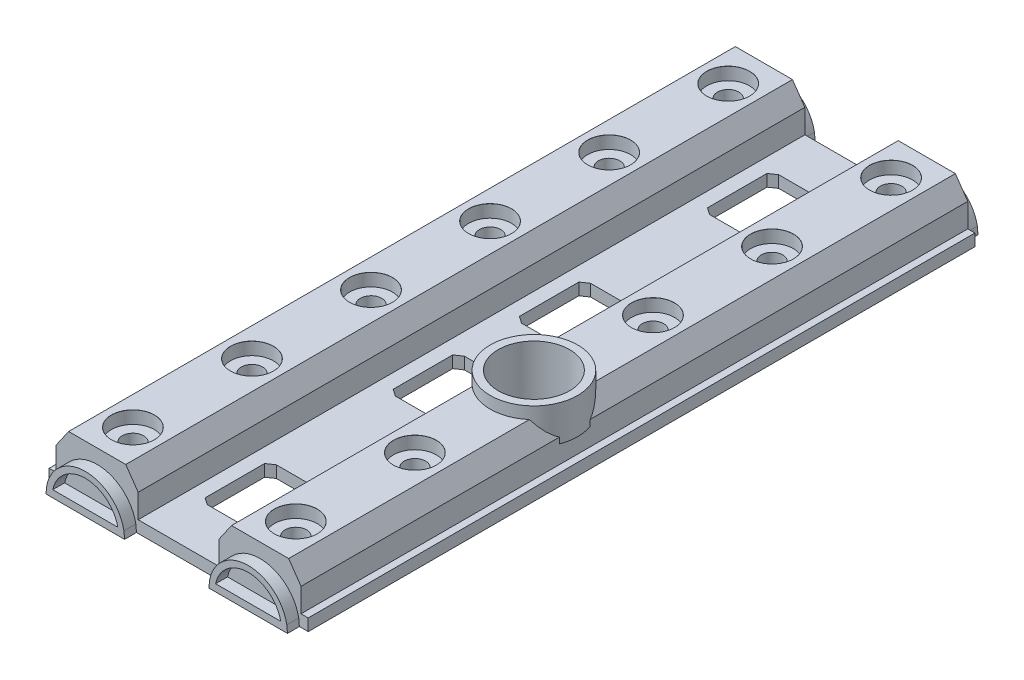
from build123d import *

# Parameters (mm, degrees)
BOSS_EXTRUDE1_DEPTH                         = 280
BOSS_EXTRUDE3_DEPTH                         = 5
MIRROR2_COPY_1_DEPTH                        = 5
CBORE_SLOT_FOR_M8_HEX_HEAD_BOLT1_AT_2_COUNT = 2
CBORE_SLOT_FOR_M8_HEX_HEAD_BOLT1_AT_2_PITCH = 50
CBORE_SLOT_FOR_M8_HEX_HEAD_BOLT1_AT_3_COUNT = 2
CBORE_SLOT_FOR_M8_HEX_HEAD_BOLT1_AT_3_PITCH = 100
CBORE_SLOT_FOR_M8_HEX_HEAD_BOLT1_AT_4_COUNT = 2
CBORE_SLOT_FOR_M8_HEX_HEAD_BOLT1_AT_4_PITCH = 150
CBORE_SLOT_FOR_M8_HEX_HEAD_BOLT1_AT_5_COUNT = 2
CBORE_SLOT_FOR_M8_HEX_HEAD_BOLT1_AT_5_PITCH = 200
CBORE_SLOT_FOR_M8_HEX_HEAD_BOLT1_AT_6_COUNT = 2
CBORE_SLOT_FOR_M8_HEX_HEAD_BOLT1_AT_6_PITCH = 250
BOSS_EXTRUDE4_DEPTH                         = 5
BOSS_EXTRUDE4_DEPTH_BACK                    = 10
SKETCH12_R                                  = 18.373536693
SKETCH14_R                                  = 15
CUT_EXTRUDE1_DEPTH                          = 28
CUT_EXTRUDE2_DEPTH                          = 294.662080045


with BuildPart() as part:
    # Sketch4 → Boss-Extrude1 (new body)
    with BuildSketch(Plane.XY):
        Polygon((-41.702855028, 2.5), (-38.702855028, 2.5), (-38.702855028, 12.5), (-33.495143371, 20), (-9.495143371, 20), (-4.287431713, 12.5), (-4.287431713, 2.5), (-1.287431713, 2.5), (26.712568287, 2.5), (29.712568287, 2.5), (29.712568287, 12.5), (34.920279944, 20), (58.920279944, 20), (64.127991602, 12.5), (64.127991602, 2.5), (67.127991602, 2.5), (67.127991602, -2.5), (26.712568287, -2.5), (-1.287431713, -2.5), (-41.702855028, -2.5), align=None)
    extrude(amount=-BOSS_EXTRUDE1_DEPTH)

    # Sketch5 → Boss-Extrude3 (add)
    with BuildSketch(Plane.XY):
        with BuildLine():
            ThreePointArc((-5.267870643, 0.487577586), (-21.495143371, 14), (-37.722416098, 0.487577586))
            Line((-37.722416098, 0.487577586), (-35.17265704, 0.487577586))
            ThreePointArc((-35.17265704, 0.487577586), (-21.495143371, 11.5), (-7.817629702, 0.487577586))
            Line((-7.817629702, 0.487577586), (-5.267870643, 0.487577586))
        make_face()
        Polygon((-37.722416098, 0.487577586), (-37.995143371, -2.5), (-4.995143371, -2.5), (-5.267870643, 0.487577586), (-7.817629702, 0.487577586), (-35.17265704, 0.487577586), align=None)
    boss_extrude3 = extrude(amount=BOSS_EXTRUDE3_DEPTH)

    # Mirror1: Boss-Extrude3 across plane
    add(boss_extrude3.mirror(Plane.ZY.offset(-12.712568287)))

    # Mirror2: Boss-Extrude3 across plane
    add(boss_extrude3.mirror(Plane.XY.offset(-140)))

    # Mirror2 copy 1 sketch → Mirror2 copy 1 (add)
    with BuildSketch(Plane(origin=(25.425136574, 0, -280), x_dir=(-1, 0, 0), z_dir=(0, 0, -1))):
        with BuildLine():
            ThreePointArc((-5.267870643, 0.487577586), (-21.495143371, 14), (-37.722416098, 0.487577586))
            Line((-37.722416098, 0.487577586), (-35.17265704, 0.487577586))
            ThreePointArc((-35.17265704, 0.487577586), (-21.495143371, 11.5), (-7.817629702, 0.487577586))
            Line((-7.817629702, 0.487577586), (-5.267870643, 0.487577586))
        make_face()
        Polygon((-37.722416098, 0.487577586), (-37.995143371, -2.5), (-4.995143371, -2.5), (-5.267870643, 0.487577586), (-7.817629702, 0.487577586), (-35.17265704, 0.487577586), align=None)
    extrude(amount=MIRROR2_COPY_1_DEPTH)

    # Sketch10 → CBORE SLOT for M8 Hex Head Bolt1 (revolve, cut)
    with BuildSketch(Plane(origin=(46.920279944, 20, -265), x_dir=(0, 0, 1), z_dir=(1, 0, 0))):
        Polygon((0, 0), (0, 34.543872786), (4.5, 31.84), (4.5, 5.3), (9.0055, 5.3), (9.0055, 0.025), (9.0305, 0), align=None)
    cbore_slot_for_m8_hex_head_bolt1 = revolve(axis=Axis((46.920279944, 26.35, -265), (0, -1, 0)), mode=Mode.SUBTRACT)

    # CBORE SLOT for M8 Hex Head Bolt1 at 2: CBORE SLOT for M8 Hex Head Bolt1 ×2
    with Locations(*[(0, 0, i * CBORE_SLOT_FOR_M8_HEX_HEAD_BOLT1_AT_2_PITCH) for i in range(1, CBORE_SLOT_FOR_M8_HEX_HEAD_BOLT1_AT_2_COUNT)]):
        add(cbore_slot_for_m8_hex_head_bolt1, mode=Mode.SUBTRACT)

    # CBORE SLOT for M8 Hex Head Bolt1 at 3: CBORE SLOT for M8 Hex Head Bolt1 ×2
    with Locations(*[(0, 0, i * CBORE_SLOT_FOR_M8_HEX_HEAD_BOLT1_AT_3_PITCH) for i in range(1, CBORE_SLOT_FOR_M8_HEX_HEAD_BOLT1_AT_3_COUNT)]):
        add(cbore_slot_for_m8_hex_head_bolt1, mode=Mode.SUBTRACT)

    # CBORE SLOT for M8 Hex Head Bolt1 at 4: CBORE SLOT for M8 Hex Head Bolt1 ×2
    with Locations(*[(0, 0, i * CBORE_SLOT_FOR_M8_HEX_HEAD_BOLT1_AT_4_PITCH) for i in range(1, CBORE_SLOT_FOR_M8_HEX_HEAD_BOLT1_AT_4_COUNT)]):
        add(cbore_slot_for_m8_hex_head_bolt1, mode=Mode.SUBTRACT)

    # CBORE SLOT for M8 Hex Head Bolt1 at 5: CBORE SLOT for M8 Hex Head Bolt1 ×2
    with Locations(*[(0, 0, i * CBORE_SLOT_FOR_M8_HEX_HEAD_BOLT1_AT_5_PITCH) for i in range(1, CBORE_SLOT_FOR_M8_HEX_HEAD_BOLT1_AT_5_COUNT)]):
        add(cbore_slot_for_m8_hex_head_bolt1, mode=Mode.SUBTRACT)

    # CBORE SLOT for M8 Hex Head Bolt1 at 6: CBORE SLOT for M8 Hex Head Bolt1 ×2
    with Locations(*[(0, 0, i * CBORE_SLOT_FOR_M8_HEX_HEAD_BOLT1_AT_6_PITCH) for i in range(1, CBORE_SLOT_FOR_M8_HEX_HEAD_BOLT1_AT_6_COUNT)]):
        add(cbore_slot_for_m8_hex_head_bolt1, mode=Mode.SUBTRACT)

    # Mirror3: CBORE SLOT for M8 Hex Head Bolt1 across plane
    add(cbore_slot_for_m8_hex_head_bolt1.mirror(Plane.ZY.offset(-12.712568287)), mode=Mode.SUBTRACT)

    # Mirror3 copy 1 sketch → Mirror3 copy 1 (revolve, cut)
    with BuildSketch(Plane(origin=(-21.495143371, 20, -215), x_dir=(0, 0, 1), z_dir=(-1, 0, 0))):
        Polygon((0, 0), (0, -34.543872786), (4.5, -31.84), (4.5, -5.3), (9.0055, -5.3), (9.0055, -0.025), (9.0305, 0), align=None)
    revolve(axis=Axis((-21.495143371, 26.35, -215), (0, 1, 0)), mode=Mode.SUBTRACT)

    # Mirror3 copy 2 sketch → Mirror3 copy 2 (revolve, cut)
    with BuildSketch(Plane(origin=(-21.495143371, 20, -165), x_dir=(0, 0, 1), z_dir=(-1, 0, 0))):
        Polygon((0, 0), (0, -34.543872786), (4.5, -31.84), (4.5, -5.3), (9.0055, -5.3), (9.0055, -0.025), (9.0305, 0), align=None)
    revolve(axis=Axis((-21.495143371, 26.35, -165), (0, 1, 0)), mode=Mode.SUBTRACT)

    # Mirror3 copy 3 sketch → Mirror3 copy 3 (revolve, cut)
    with BuildSketch(Plane(origin=(-21.495143371, 20, -115), x_dir=(0, 0, 1), z_dir=(-1, 0, 0))):
        Polygon((0, 0), (0, -34.543872786), (4.5, -31.84), (4.5, -5.3), (9.0055, -5.3), (9.0055, -0.025), (9.0305, 0), align=None)
    revolve(axis=Axis((-21.495143371, 26.35, -115), (0, 1, 0)), mode=Mode.SUBTRACT)

    # Mirror3 copy 4 sketch → Mirror3 copy 4 (revolve, cut)
    with BuildSketch(Plane(origin=(-21.495143371, 20, -65), x_dir=(0, 0, 1), z_dir=(-1, 0, 0))):
        Polygon((0, 0), (0, -34.543872786), (4.5, -31.84), (4.5, -5.3), (9.0055, -5.3), (9.0055, -0.025), (9.0305, 0), align=None)
    revolve(axis=Axis((-21.495143371, 26.35, -65), (0, 1, 0)), mode=Mode.SUBTRACT)

    # Mirror3 copy 5 sketch → Mirror3 copy 5 (revolve, cut)
    with BuildSketch(Plane(origin=(-21.495143371, 20, -15), x_dir=(0, 0, 1), z_dir=(-1, 0, 0))):
        Polygon((0, 0), (0, -34.543872786), (4.5, -31.84), (4.5, -5.3), (9.0055, -5.3), (9.0055, -0.025), (9.0305, 0), align=None)
    revolve(axis=Axis((-21.495143371, 26.35, -15), (0, 1, 0)), mode=Mode.SUBTRACT)

    # Sketch12 → Boss-Extrude4 (add, two sides: drawn at the far end of the back side and taken through both)
    with BuildSketch(Plane(origin=(0, 20, 0), x_dir=(1, 0, 0), z_dir=(0, 1, 0)).offset(-BOSS_EXTRUDE4_DEPTH_BACK)):
        with Locations(Location((46.920279944, 115, 0), (0, 0, 270))):
            Circle(SKETCH12_R)
    extrude(amount=BOSS_EXTRUDE4_DEPTH + BOSS_EXTRUDE4_DEPTH_BACK)

    # Sketch14 → Cut-Extrude1 (cut)
    with BuildSketch(Plane(origin=(0, 25, 0), x_dir=(1, 0, 0), z_dir=(0, 1, 0))):
        with Locations(Location((46.920279944, 115, 0), (0, 0, 270))):
            Circle(SKETCH14_R)
    extrude(amount=-CUT_EXTRUDE1_DEPTH, mode=Mode.SUBTRACT)

    # Sketch16 → Cut-Extrude2 (cut, through all)
    with BuildSketch(Plane(origin=(0, 2.5, 0), x_dir=(1, 0, 0), z_dir=(0, 1, 0))):
        Polygon((20.712568287, 20), (4.712568287, 20), (1.802568287, 22), (1.802568287, 47), (4.712568287, 49), (20.712568287, 49), (23.622568287, 47), (23.622568287, 22), align=None)
        Polygon((23.622568287, 101), (20.712568287, 99), (4.712568287, 99), (1.802568287, 101), (1.802568287, 126), (4.712568287, 128), (20.712568287, 128), (23.622568287, 126), align=None)
    cut_extrude2 = extrude(amount=-CUT_EXTRUDE2_DEPTH, mode=Mode.SUBTRACT)

    # Mirror4: Cut-Extrude2 across plane
    add(cut_extrude2.mirror(Plane.XY.offset(-140)), mode=Mode.SUBTRACT)


solid = part.part
